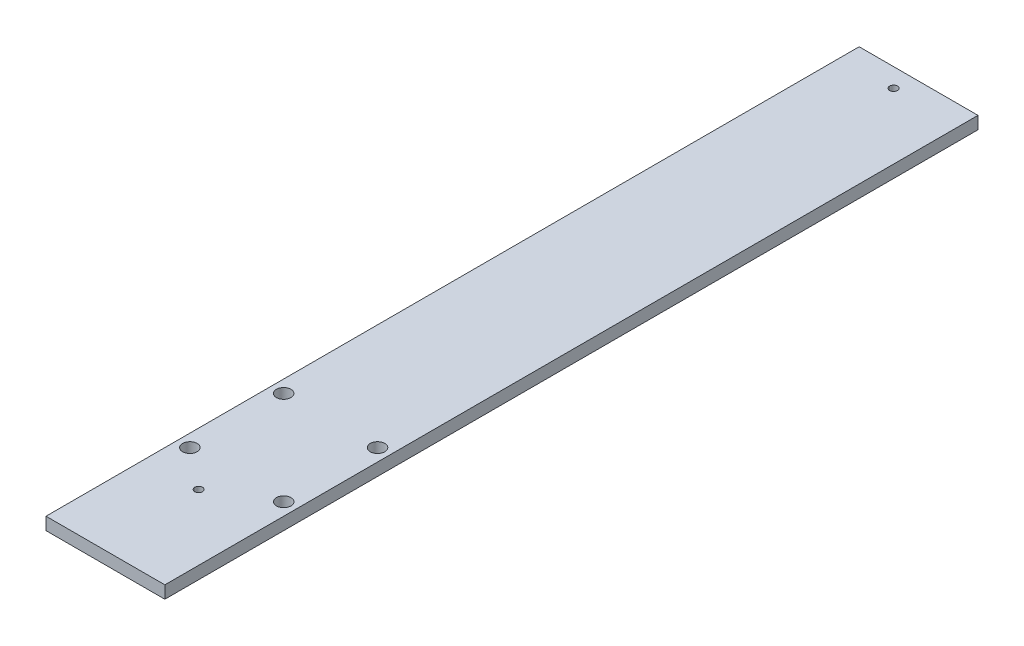
from build123d import *

# Parameters (mm, degrees)
SKETCH1_W               = 241.3
SKETCH1_H               = 1651
BOSS_EXTRUDE1_DEPTH     = 25.4
CUT_EXTRUDE1_DEPTH      = 1669.733606661
CUT_EXTRUDE1_DEPTH_BACK = 1669.733606661
SKETCH2_R               = 7.9375
SKETCH3_R               = 14.72946
CUT_EXTRUDE2_DEPTH      = 1669.733606661


with BuildPart() as part:
    # Sketch1 → Boss-Extrude1 (new body)
    with BuildSketch(Plane(origin=(0, 0, 0), x_dir=(1, 0, 0), z_dir=(0, 1, 0))):
        with Locations((120.65, -825.5)):
            Rectangle(SKETCH1_W, SKETCH1_H)
    extrude(amount=BOSS_EXTRUDE1_DEPTH)

    # Sketch2 → Cut-Extrude1 (cut, two sides: drawn at the far end of the back side and taken through both)
    with BuildSketch(Plane(origin=(0, 25.4, 0), x_dir=(1, 0, 0), z_dir=(0, 1, 0)).offset(-CUT_EXTRUDE1_DEPTH_BACK)):
        with Locations(Location((107.95, -38.1, 0), (0, 0, 270))):
            Circle(SKETCH2_R)
        with Locations(Location((107.95, -1449.0573, 0), (0, 0, 270))):
            Circle(SKETCH2_R)
    extrude(amount=CUT_EXTRUDE1_DEPTH + CUT_EXTRUDE1_DEPTH_BACK, mode=Mode.SUBTRACT)

    # Sketch3 → Cut-Extrude2 (cut, through all)
    with BuildSketch(Plane.XZ):
        with Locations(Location((215.9, 1193.8, 0), (0, 0, 270))):
            Circle(SKETCH3_R)
        with Locations(Location((25.4, 1193.8, 0), (0, 0, 270))):
            Circle(SKETCH3_R)
        with Locations(Location((25.4, 1384.3, 0), (0, 0, 270))):
            Circle(SKETCH3_R)
        with Locations(Location((215.9, 1384.3, 0), (0, 0, 270))):
            Circle(SKETCH3_R)
    extrude(amount=-CUT_EXTRUDE2_DEPTH, mode=Mode.SUBTRACT)


solid = part.part
